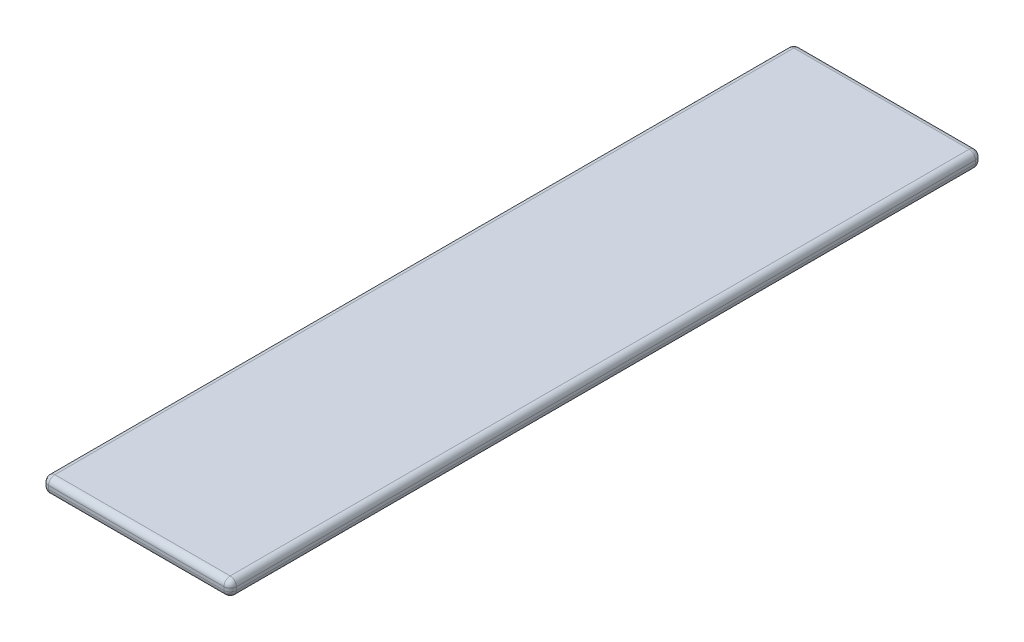
from build123d import *

# Parameters (mm, degrees)
SKETCH1_W           = 254
SKETCH1_H           = 6.35
BOSS_EXTRUDE1_DEPTH = 304.8
CUT_EXTRUDE1_DEPTH  = 304.8
SKETCH4_W           = 181.607961477
SKETCH4_H           = 399.050444088
CUT_EXTRUDE2_DEPTH  = 397.811494919
FILLET2_R           = 2.54


with BuildPart() as part:
    # Sketch1 → Boss-Extrude1 (new body)
    with BuildSketch(Plane.XY):
        with Locations((-127, 3.175)):
            Rectangle(SKETCH1_W, SKETCH1_H)
    extrude(amount=BOSS_EXTRUDE1_DEPTH)

    # Sketch2 → Cut-Extrude1 (cut)
    with BuildSketch(Plane(origin=(0, 6.35, 0), x_dir=(1, 0, 0), z_dir=(0, 1, 0))):
        Polygon((-101.6, -304.8), (-254, 0), (-254, -304.8), align=None)
    extrude(amount=-CUT_EXTRUDE1_DEPTH, mode=Mode.SUBTRACT)

    # Sketch4 → Cut-Extrude2 (cut, through all)
    with BuildSketch(Plane(origin=(0, 6.35, 0), x_dir=(1, 0, 0), z_dir=(0, 1, 0))):
        with Locations((-167.003980738, -164.054917068)):
            Rectangle(SKETCH4_W, SKETCH4_H)
    extrude(amount=-CUT_EXTRUDE2_DEPTH, mode=Mode.SUBTRACT)

    # Fillet2
    fillet2_edges = [part.edges().sort_by_distance(p)[0] for p in [
        (-38.1, 0, 304.8),
        (-76.2, 3.175, 0),
        (-76.2, 6.35, 152.4),
        (-76.2, 3.175, 304.8),
        (-76.2, 0, 152.4),
        (0, 3.175, 304.8),
        (-38.1, 0, 0),
        (-38.1, 6.35, 0),
        (0, 3.175, 0),
        (0, 0, 152.4),
        (0, 6.35, 152.4),
        (-38.1, 6.35, 304.8),
    ]]
    fillet(fillet2_edges, radius=FILLET2_R)


solid = part.part
